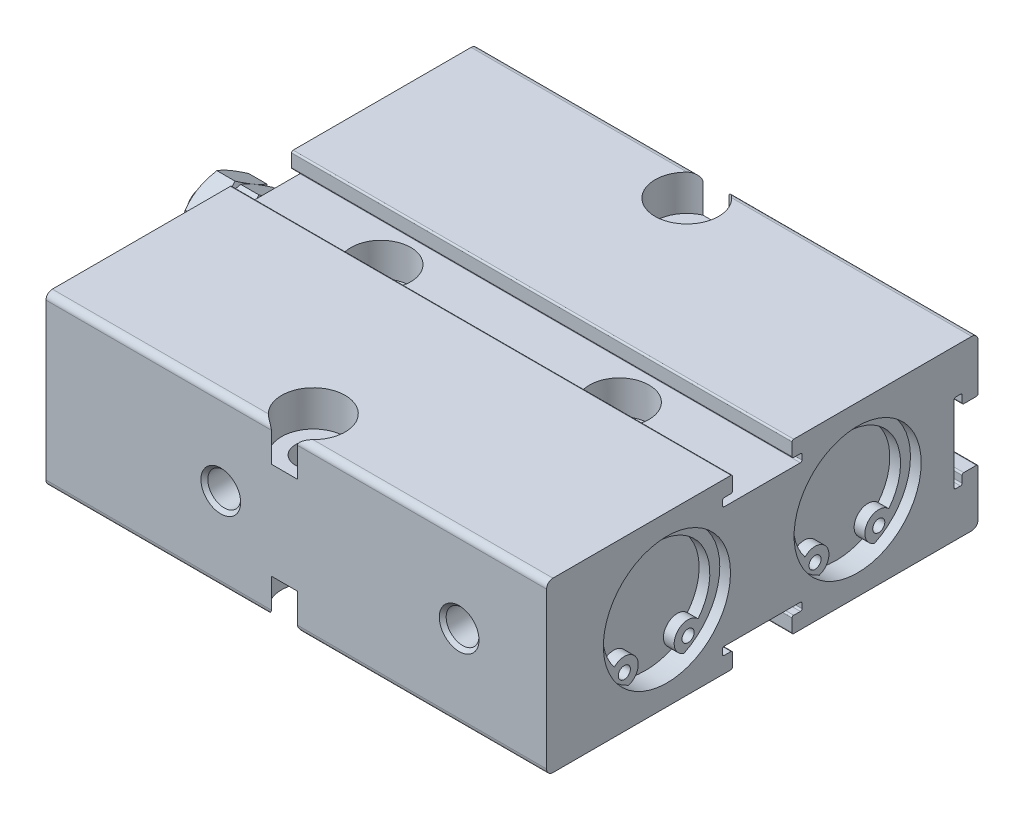
from build123d import *

# Parameters (mm, degrees)
EXTRUDE_1_DEPTH     = 63
SKETCH_8_R          = 8
CUT_EXTRUDE_1_DEPTH = 2.7
SKETCH_9_R          = 8
CUT_EXTRUDE_2_DEPTH = 2.7
CUT_EXTRUDE_START   = 2.7
SKETCH_10_R         = 8
CUT_EXTRUDE_3_DEPTH = 2.7
SKETCH_11_R         = 8
CUT_EXTRUDE_4_DEPTH = 2.7
SKETCH_15_W         = 30
SKETCH_15_H         = 60
CUT_EXTRUDE_5_DEPTH = 15
SKETCH_17_R         = 0.76
EXTRUDE_2_DEPTH     = 3.75
SKETCH_18_R         = 0.76
EXTRUDE_3_DEPTH     = 3.75
EXTRUDE_START       = 3.75
SKETCH_19_R         = 0.76
EXTRUDE_4_DEPTH     = 3.75
SKETCH_20_R         = 0.76
EXTRUDE_5_DEPTH     = 3.75


with BuildPart() as part:
    # 草图1 → 凸台-拉伸1 (new body)
    with BuildSketch(Plane(origin=(0, 0, 0), x_dir=(0, 0, -1), z_dir=(1, 0, 0))):
        with BuildLine():
            Line((-26.35, 0), (-3.95, 0))
            ThreePointArc((-3.95, 0), (-3.808578644, 0.058578644), (-3.75, 0.2))
            Line((-3.75, 0.2), (-3.75, 1.8))
            ThreePointArc((-3.75, 1.8), (-3.808578644, 1.941421356), (-3.95, 2))
            Line((-3.95, 2), (-4.8, 2))
            ThreePointArc((-4.8, 2), (-4.941421356, 2.058578644), (-5, 2.2))
            Line((-5, 2.2), (-5, 2.8))
            ThreePointArc((-5, 2.8), (-4.941421356, 2.941421356), (-4.8, 3))
            Line((-4.8, 3), (4.8, 3))
            ThreePointArc((4.8, 3), (4.941421356, 2.941421356), (5, 2.8))
            Line((5, 2.8), (5, 2.2))
            ThreePointArc((5, 2.2), (4.941421356, 2.058578644), (4.8, 2))
            Line((4.8, 2), (3.95, 2))
            ThreePointArc((3.95, 2), (3.808578644, 1.941421356), (3.75, 1.8))
            Line((3.75, 1.8), (3.75, 0.2))
            ThreePointArc((3.75, 0.2), (3.808578644, 0.058578644), (3.95, 0))
            Line((3.95, 0), (26.35, 0))
            ThreePointArc((26.35, 0), (26.915685425, 0.234314575), (27.15, 0.8))
            Line((27.15, 0.8), (27.15, 6.65))
            ThreePointArc((27.15, 6.65), (27.091421356, 6.791421356), (26.95, 6.85))
            Line((26.95, 6.85), (25.35, 6.85))
            ThreePointArc((25.35, 6.85), (25.208578644, 6.791421356), (25.15, 6.65))
            Line((25.15, 6.65), (25.15, 5.8))
            ThreePointArc((25.15, 5.8), (25.091421356, 5.658578644), (24.95, 5.6))
            Line((24.95, 5.6), (24.35, 5.6))
            ThreePointArc((24.35, 5.6), (24.208578644, 5.658578644), (24.15, 5.8))
            Line((24.15, 5.8), (24.15, 15.4))
            ThreePointArc((24.15, 15.4), (24.208578644, 15.541421356), (24.35, 15.6))
            Line((24.35, 15.6), (24.95, 15.6))
            ThreePointArc((24.95, 15.6), (25.091421356, 15.541421356), (25.15, 15.4))
            Line((25.15, 15.4), (25.15, 14.55))
            ThreePointArc((25.15, 14.55), (25.208578644, 14.408578644), (25.35, 14.35))
            Line((25.35, 14.35), (26.95, 14.35))
            ThreePointArc((26.95, 14.35), (27.091421356, 14.408578644), (27.15, 14.55))
            Line((27.15, 14.55), (27.15, 20.4))
            ThreePointArc((27.15, 20.4), (26.915685425, 20.965685425), (26.35, 21.2))
            Line((26.35, 21.2), (3.95, 21.2))
            ThreePointArc((3.95, 21.2), (3.808578644, 21.141421356), (3.75, 21))
            Line((3.75, 21), (3.75, 19.4))
            ThreePointArc((3.75, 19.4), (3.808578644, 19.258578644), (3.95, 19.2))
            Line((3.95, 19.2), (4.8, 19.2))
            ThreePointArc((4.8, 19.2), (4.941421356, 19.141421356), (5, 19))
            Line((5, 19), (5, 18.4))
            ThreePointArc((5, 18.4), (4.941421356, 18.258578644), (4.8, 18.2))
            Line((4.8, 18.2), (-4.8, 18.2))
            ThreePointArc((-4.8, 18.2), (-4.941421356, 18.258578644), (-5, 18.4))
            Line((-5, 18.4), (-5, 19))
            ThreePointArc((-5, 19), (-4.941421356, 19.141421356), (-4.8, 19.2))
            Line((-4.8, 19.2), (-3.95, 19.2))
            ThreePointArc((-3.95, 19.2), (-3.808578644, 19.258578644), (-3.75, 19.4))
            Line((-3.75, 19.4), (-3.75, 21))
            ThreePointArc((-3.75, 21), (-3.808578644, 21.141421356), (-3.95, 21.2))
            Line((-3.95, 21.2), (-26.35, 21.2))
            ThreePointArc((-26.35, 21.2), (-26.915685425, 20.965685425), (-27.15, 20.4))
            Line((-27.15, 20.4), (-27.15, 0.8))
            ThreePointArc((-27.15, 0.8), (-26.915685425, 0.234314575), (-26.35, 0))
        make_face()
    extrude(amount=EXTRUDE_1_DEPTH)

    # 草图2 → 切除-旋转1 (revolve, cut)
    with BuildSketch(Plane.XY.offset(12)):
        Polygon((0, 10.6), (0, 14.6), (33.4, 14.6), (33.4, 18.6), (57.6, 18.6), (57.6, 10.6), align=None)
    revolve(axis=Axis((57.6, 10.6, 12), (-1, 0, 0)), mode=Mode.SUBTRACT)

    # 草图3 → 切除-旋转2 (revolve, cut)
    with BuildSketch(Plane.XY.offset(-12)):
        Polygon((0, 10.6), (0, 14.6), (33.4, 14.6), (33.4, 18.6), (57.6, 18.6), (57.6, 10.6), align=None)
    revolve(axis=Axis((57.6, 10.6, -12), (-1, 0, 0)), mode=Mode.SUBTRACT)

    # 草图4 → 切除-旋转3 (revolve, cut)
    with BuildSketch(Plane.XY):
        Polygon((15, 21.2), (18.75, 21.2), (18.75, 14), (17.25, 14), (17.25, 7.2), (18.75, 7.2), (18.75, 0), (15, 0), align=None)
    revolve(axis=Axis((15, 0, 0), (0, 1, 0)), mode=Mode.SUBTRACT)

    # 草图5 → 切除-旋转4 (revolve, cut)
    with BuildSketch(Plane.XY):
        Polygon((45, 21.2), (48.75, 21.2), (48.75, 14), (47.25, 14), (47.25, 7.2), (48.75, 7.2), (48.75, 0), (45, 0), align=None)
    revolve(axis=Axis((45, 0, 0), (0, 1, 0)), mode=Mode.SUBTRACT)

    # 草图6 → 切除-旋转5 (revolve, cut)
    with BuildSketch(Plane.XY.offset(23.5)):
        Polygon((30, 21.2), (34, 21.2), (34, 16.7), (32.25, 16.7), (32.25, 4.5), (34, 4.5), (34, 0), (30, 0), align=None)
    revolve(axis=Axis((30, 0, 23.5), (0, 1, 0)), mode=Mode.SUBTRACT)

    # 草图7 → 切除-旋转6 (revolve, cut)
    with BuildSketch(Plane.XY.offset(-23.5)):
        Polygon((30, 21.2), (34, 21.2), (34, 16.7), (32.25, 16.7), (32.25, 4.5), (34, 4.5), (34, 0), (30, 0), align=None)
    revolve(axis=Axis((30, 0, -23.5), (0, 1, 0)), mode=Mode.SUBTRACT)

    # 草图8 → 切除-拉伸1 (cut)
    with BuildSketch(Plane(origin=(63, 0, 0), x_dir=(0, 0, -1), z_dir=(1, 0, 0))):
        with Locations((12, 10.6)):
            Circle(SKETCH_8_R)
    extrude(amount=-CUT_EXTRUDE_1_DEPTH, mode=Mode.SUBTRACT)

    # 草图9 → 切除-拉伸2 (cut)
    with BuildSketch(Plane(origin=(63, 0, 0), x_dir=(0, 0, -1), z_dir=(1, 0, 0))):
        with Locations((-12, 10.6)):
            Circle(SKETCH_9_R)
    extrude(amount=-CUT_EXTRUDE_2_DEPTH, mode=Mode.SUBTRACT)

    # 草图10 → 切除-拉伸3 (cut)
    with BuildSketch(Plane(origin=(0, 0, 0), x_dir=(0, 0, -1), z_dir=(1, 0, 0)).offset(CUT_EXTRUDE_START)):
        with Locations((12, 10.6)):
            Circle(SKETCH_10_R)
    extrude(amount=-CUT_EXTRUDE_3_DEPTH, mode=Mode.SUBTRACT)

    # 草图11 → 切除-拉伸4 (cut)
    with BuildSketch(Plane(origin=(0, 0, 0), x_dir=(0, 0, -1), z_dir=(1, 0, 0)).offset(CUT_EXTRUDE_START)):
        with Locations((-12, 10.6)):
            Circle(SKETCH_11_R)
    extrude(amount=-CUT_EXTRUDE_4_DEPTH, mode=Mode.SUBTRACT)

    # 草图12 → 切除-旋转7 (revolve, cut)
    with BuildSketch(Plane(origin=(22, 0, 0), x_dir=(0, 0, -1), z_dir=(1, 0, 0))):
        Polygon((-27.15, 10.6), (-27.15, 13.1), (-26.717, 12.667), (-22.15, 12.667), (-22.15, 10.6), align=None)
    revolve(axis=Axis((22, 10.6, 22.15), (0, 0, 1)), mode=Mode.SUBTRACT)

    # 草图13 → 切除-旋转8 (revolve, cut)
    with BuildSketch(Plane(origin=(52, 0, 0), x_dir=(0, 0, -1), z_dir=(1, 0, 0))):
        Polygon((-27.15, 10.6), (-27.15, 13.1), (-26.717, 12.667), (-22.15, 12.667), (-22.15, 10.6), align=None)
    revolve(axis=Axis((52, 10.6, 22.15), (0, 0, 1)), mode=Mode.SUBTRACT)

    # 草图14 → 旋转1 (revolve)
    with BuildSketch(Plane.XY):
        Polygon((-6, 13.5), (-6, 17.5), (-5.538119785, 18.3), (-3.461880215, 18.3), (-3, 17.5), (-2.538119785, 18.3), (-0.461880215, 18.3), (0, 17.5), (0, 13.5), align=None)
    revolve(axis=Axis((0, 13.5, 0), (-1, 0, 0)))

    # 草图15 → 切除-拉伸5 (cut)
    with BuildSketch(Plane(origin=(0, 0, 0), x_dir=(0, 0, -1), z_dir=(1, 0, 0))):
        with Locations((0, 25.6)):
            Rectangle(SKETCH_15_W, SKETCH_15_H)
        Polygon((-4, 15.809401077), (-4, 11.190598923), (0, 8.881197846), (4, 11.190598923), (4, 15.809401077), (0, 18.118802154), align=None, mode=Mode.SUBTRACT)
    extrude(amount=-CUT_EXTRUDE_5_DEPTH, mode=Mode.SUBTRACT)

    # 草图16 → 旋转2 (revolve)
    with BuildSketch(Plane.XY):
        Polygon((-7.5, 13.5), (-7.5, 15.5), (-7, 16), (0, 16), (0, 13.5), align=None)
    revolve(axis=Axis((0, 13.5, 0), (-1, 0, 0)))

    # 草图17 → 凸台-拉伸2 (add)
    with BuildSketch(Plane(origin=(61.65, 0, 0), x_dir=(0, 0, -1), z_dir=(1, 0, 0))):
        with BuildLine():
            ThreePointArc((17.072442994, 3.679419227), (12, 19), (6.927557006, 3.679419227))
            ThreePointArc((6.927557006, 3.679419227), (9.734936134, 5.203033416), (6.72902691, 6.283444216))
            ThreePointArc((6.72902691, 6.283444216), (12, 17.25), (17.27097309, 6.283444216))
            ThreePointArc((17.27097309, 6.283444216), (14.265063866, 5.203033416), (17.072442994, 3.679419227))
        make_face()
        with Locations((16.01, 5.07)):
            Circle(SKETCH_17_R, mode=Mode.SUBTRACT)
        with Locations((7.99, 5.07)):
            Circle(SKETCH_17_R, mode=Mode.SUBTRACT)
    extrude(amount=-EXTRUDE_2_DEPTH)

    # 草图18 → 凸台-拉伸3 (add)
    with BuildSketch(Plane(origin=(61.65, 0, 0), x_dir=(0, 0, -1), z_dir=(1, 0, 0))):
        with BuildLine():
            ThreePointArc((-6.927557006, 3.679419227), (-12, 19), (-17.072442994, 3.679419227))
            ThreePointArc((-17.072442994, 3.679419227), (-14.265063866, 5.203033416), (-17.27097309, 6.283444216))
            ThreePointArc((-17.27097309, 6.283444216), (-12, 17.25), (-6.72902691, 6.283444216))
            ThreePointArc((-6.72902691, 6.283444216), (-9.734936134, 5.203033416), (-6.927557006, 3.679419227))
        make_face()
        with Locations((-7.99, 5.07)):
            Circle(SKETCH_18_R, mode=Mode.SUBTRACT)
        with Locations((-16.01, 5.07)):
            Circle(SKETCH_18_R, mode=Mode.SUBTRACT)
    extrude(amount=-EXTRUDE_3_DEPTH)

    # 草图19 → 凸台-拉伸4 (add)
    with BuildSketch(Plane(origin=(1.35, 0, 0), x_dir=(0, 0, -1), z_dir=(1, 0, 0)).offset(EXTRUDE_START)):
        with BuildLine():
            ThreePointArc((17.072442994, 3.679419227), (12, 19), (6.927557006, 3.679419227))
            ThreePointArc((6.927557006, 3.679419227), (9.734936134, 5.203033416), (6.72902691, 6.283444216))
            ThreePointArc((6.72902691, 6.283444216), (12, 17.25), (17.27097309, 6.283444216))
            ThreePointArc((17.27097309, 6.283444216), (14.265063866, 5.203033416), (17.072442994, 3.679419227))
        make_face()
        with Locations((16.01, 5.07)):
            Circle(SKETCH_19_R, mode=Mode.SUBTRACT)
        with Locations((7.99, 5.07)):
            Circle(SKETCH_19_R, mode=Mode.SUBTRACT)
    extrude(amount=-EXTRUDE_4_DEPTH)

    # 草图20 → 凸台-拉伸5 (add)
    with BuildSketch(Plane(origin=(1.35, 0, 0), x_dir=(0, 0, -1), z_dir=(1, 0, 0)).offset(EXTRUDE_START)):
        with BuildLine():
            ThreePointArc((-6.927557006, 3.679419227), (-12, 19), (-17.072442994, 3.679419227))
            ThreePointArc((-17.072442994, 3.679419227), (-14.265063866, 5.203033416), (-17.27097309, 6.283444216))
            ThreePointArc((-17.27097309, 6.283444216), (-12, 17.25), (-6.72902691, 6.283444216))
            ThreePointArc((-6.72902691, 6.283444216), (-9.734936134, 5.203033416), (-6.927557006, 3.679419227))
        make_face()
        with Locations((-7.99, 5.07)):
            Circle(SKETCH_20_R, mode=Mode.SUBTRACT)
        with Locations((-16.01, 5.07)):
            Circle(SKETCH_20_R, mode=Mode.SUBTRACT)
    extrude(amount=-EXTRUDE_5_DEPTH)

    # 草图21 → 切除-旋转9 (revolve, cut)
    with BuildSketch(Plane.XY):
        Polygon((0, 7.7), (0, 10.2), (0.433, 9.767), (5, 9.767), (5, 7.7), align=None)
    revolve(axis=Axis((5, 7.7, 0), (-1, 0, 0)), mode=Mode.SUBTRACT)


solid = part.part
